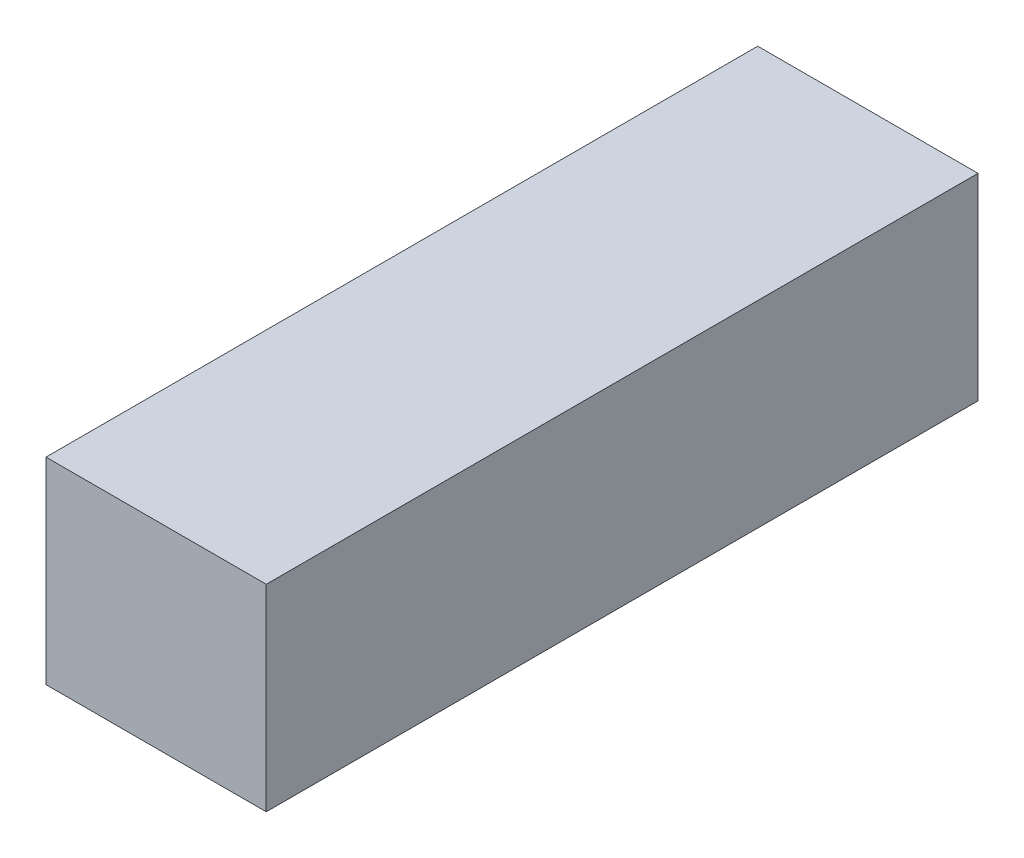
from build123d import *

# Parameters (mm, degrees)
SKETCH1_W           = 48.26
SKETCH1_H           = 155.956
BOSS_EXTRUDE1_DEPTH = 43.18


with BuildPart() as part:
    # Sketch1 → Boss-Extrude1 (new body)
    with BuildSketch(Plane(origin=(0, 0, 0), x_dir=(1, 0, 0), z_dir=(0, 1, 0))):
        with Locations((24.13, 77.978)):
            Rectangle(SKETCH1_W, SKETCH1_H)
    extrude(amount=BOSS_EXTRUDE1_DEPTH)


solid = part.part
